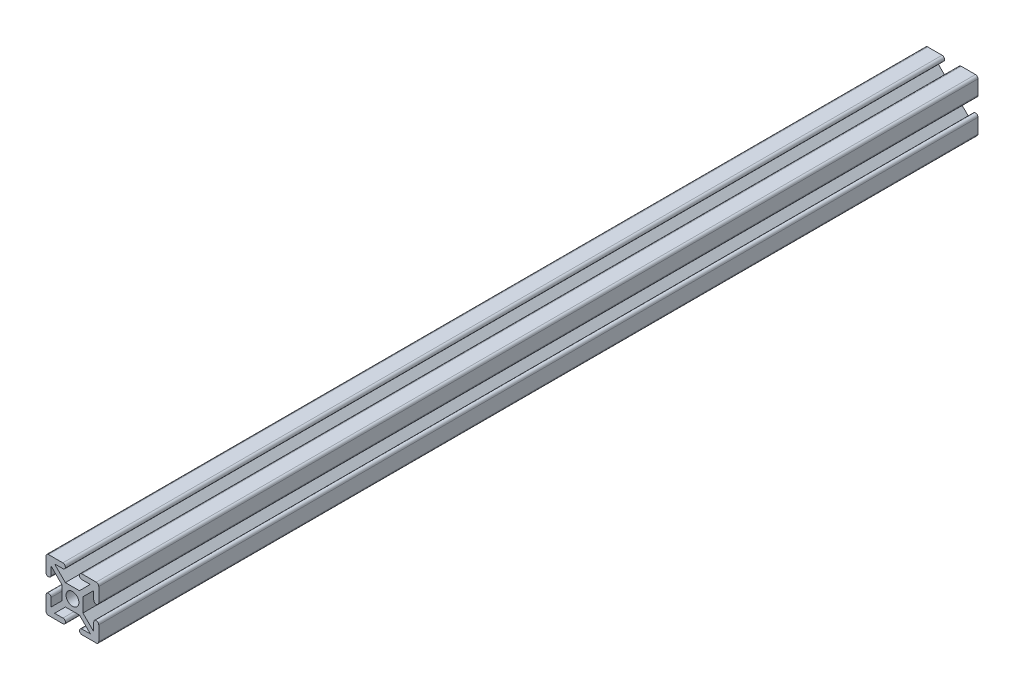
from build123d import *

# Parameters (mm, degrees)
CROQUIS1_R              = 3.645
SALIENTE_EXTRUIR1_DEPTH = 500


with BuildPart() as part:
    # Croquis1 → Saliente-Extruir1 (new body)
    with BuildSketch(Plane.XY):
        with BuildLine():
            Line((12.141560431, -25.332491675), (16.866560431, -25.332491675))
            Line((16.866560431, -25.332491675), (10.716560431, -19.182491675))
            Line((10.716560431, -19.182491675), (2.716560431, -19.182491675))
            Line((2.716560431, -19.182491675), (-3.433439569, -25.332491675))
            Line((-3.433439569, -25.332491675), (1.291560431, -25.332491675))
            ThreePointArc((1.291560431, -25.332491675), (2.716560431, -26.757491675), (1.291560431, -28.182491675))
            Line((1.291560431, -28.182491675), (-6.884875341, -28.156055903))
            ThreePointArc((-6.884875341, -28.156055903), (-7.87380959, -27.746425924), (-8.283439569, -26.757491675))
            Line((-8.283439569, -26.757491675), (-8.283439569, -18.607491675))
            ThreePointArc((-8.283439569, -18.607491675), (-6.884875341, -17.208927448), (-5.486311114, -18.607491675))
            Line((-5.486311114, -18.607491675), (-5.486311114, -23.332491675))
            Line((-5.486311114, -23.332491675), (0.663688886, -17.182491675))
            Line((0.663688886, -17.182491675), (0.663688886, -9.182491675))
            Line((0.663688886, -9.182491675), (-5.486311114, -3.032491675))
            Line((-5.486311114, -3.032491675), (-5.486311114, -7.757491675))
            ThreePointArc((-5.486311114, -7.757491675), (-6.911311114, -9.182491675), (-8.336311114, -7.757491675))
            Line((-8.336311114, -7.757491675), (-8.336311114, 0.392461735))
            ThreePointArc((-8.336311114, 0.392461735), (-7.918938277, 1.400088898), (-6.911311114, 1.817461735))
            Line((-6.911311114, 1.817461735), (1.238688886, 1.817461735))
            ThreePointArc((1.238688886, 1.817461735), (2.663688886, 0.392461735), (1.238688886, -1.032538265))
            Line((1.238688886, -1.032538265), (-3.486311114, -1.032538265))
            Line((-3.486311114, -1.032538265), (2.663688886, -7.182538265))
            Line((2.663688886, -7.182538265), (10.663688886, -7.182538265))
            Line((10.663688886, -7.182538265), (16.813688886, -1.032538265))
            Line((16.813688886, -1.032538265), (12.088688886, -1.032538265))
            ThreePointArc((12.088688886, -1.032538265), (10.663688886, 0.392461735), (12.088688886, 1.817461735))
            Line((12.088688886, 1.817461735), (20.238688886, 1.817461735))
            ThreePointArc((20.238688886, 1.817461735), (21.246316049, 1.400088898), (21.663688886, 0.392461735))
            Line((21.663688886, 0.392461735), (21.663688886, -7.65379458))
            ThreePointArc((21.663688886, -7.65379458), (20.238688886, -9.07879458), (18.813688886, -7.65379458))
            Line((18.813688886, -7.65379458), (18.813688886, -3.032538265))
            Line((18.813688886, -3.032538265), (12.663688886, -9.182538265))
            Line((12.663688886, -9.182538265), (12.663688886, -17.182538265))
            Line((12.663688886, -17.182538265), (18.813688886, -23.332538265))
            Line((18.813688886, -23.332538265), (18.813688886, -18.50379458))
            ThreePointArc((18.813688886, -18.50379458), (20.238688886, -17.07879458), (21.663688886, -18.50379458))
            Line((21.663688886, -18.50379458), (21.663688886, -26.757491675))
            ThreePointArc((21.663688886, -26.757491675), (21.246316049, -27.765118839), (20.238688886, -28.182491675))
            Line((20.238688886, -28.182491675), (12.141560431, -28.182491675))
            ThreePointArc((12.141560431, -28.182491675), (10.716560431, -26.757491675), (12.141560431, -25.332491675))
        make_face()
        with Locations((6.716560431, -13.182491675)):
            Circle(CROQUIS1_R, mode=Mode.SUBTRACT)
    extrude(amount=SALIENTE_EXTRUIR1_DEPTH)


solid = part.part
